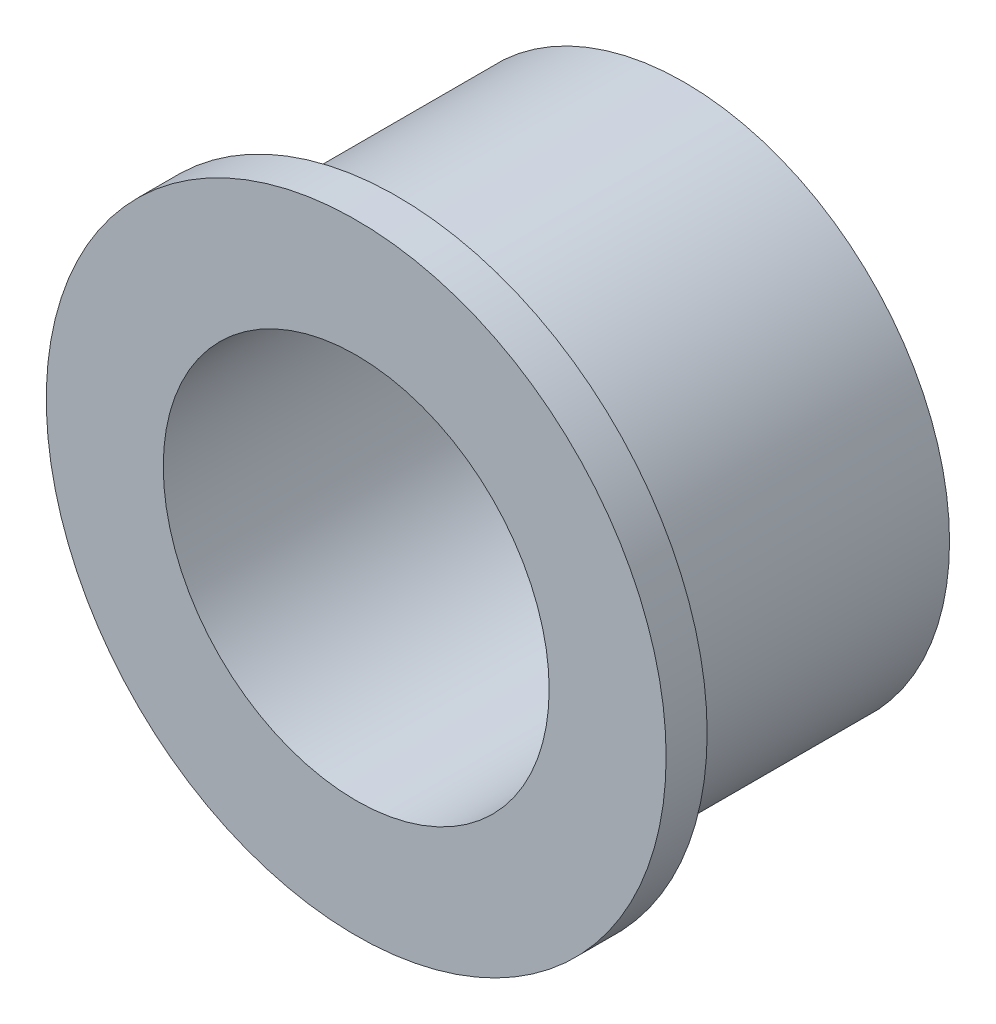
from build123d import *

# Parameters (mm, degrees)
SCALE1_SCALE = 0.6


with BuildPart() as part:
    # Sketch1 → Revolve1 (revolve)
    with BuildSketch(Plane(origin=(0, 0, 0), x_dir=(0, 0, -1), z_dir=(1, 0, 0)), mode=Mode.PRIVATE) as revolve1_sk:
        Polygon((0, 2.032), (0, 3.2639), (0.4318, 3.2639), (0.4318, 2.794), (3.4544, 2.794), (3.4544, 2.032), align=None)
    revolve(revolve1_sk.sketch.rotate(Axis((0, 0, 0), (0, 0, -1)), 90), axis=Axis((0, 0, 0), (0, 0, -1)))


with BuildPart() as part_1:
    # Scale1: scaled about (0, 0, -1.593867998)
    add(part.part.scale(SCALE1_SCALE).moved(Location((0, 0, -0.637547199))))


solid = part_1.part
